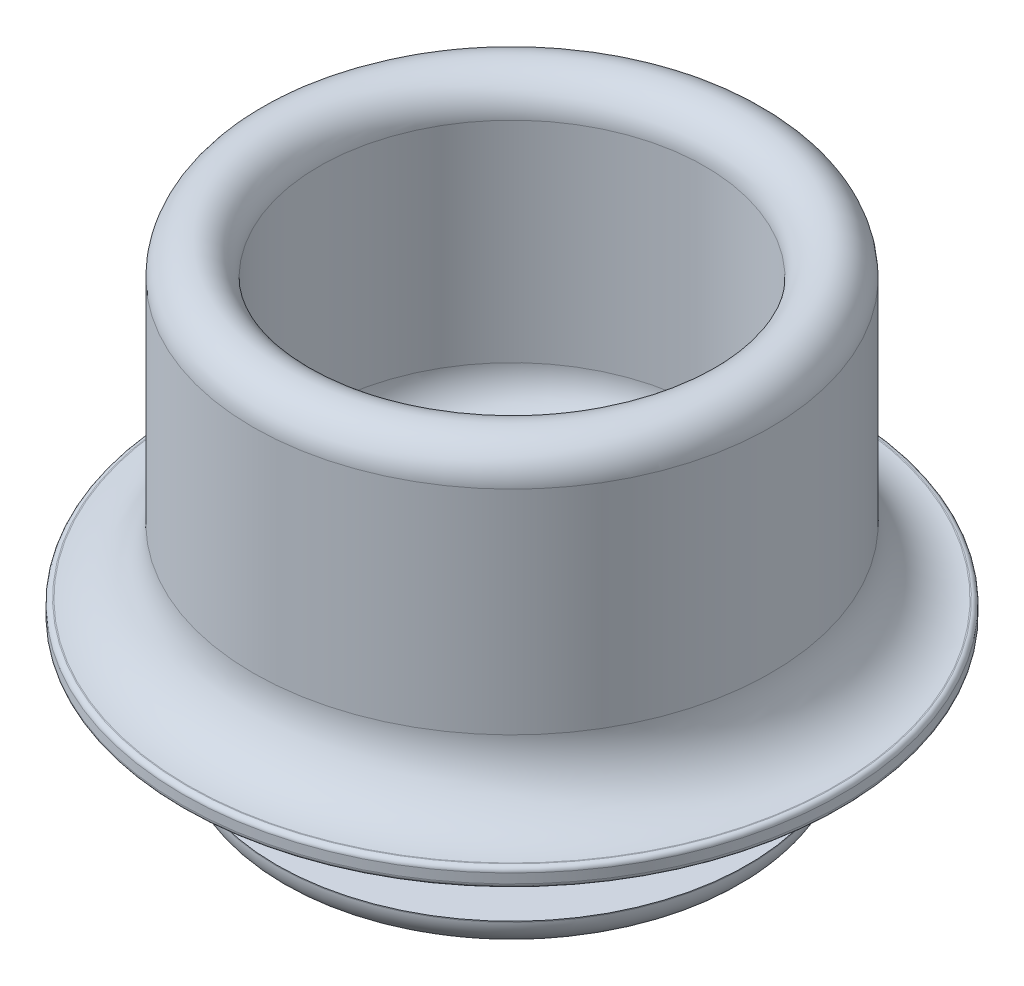
from build123d import *


with BuildPart() as part:
    # Esquisse1 → Révolution1 (revolve)
    with BuildSketch(Plane.XY, mode=Mode.PRIVATE) as r_volution1_sk:
        with BuildLine():
            Line((0, 0), (0, 0.3))
            Line((0, 0.3), (-0.008851171, 0.3))
            ThreePointArc((-0.008851171, 0.3), (-0.114917188, 0.343933983), (-0.158851171, 0.45))
            Line((-0.158851171, 0.45), (-0.158851171, 0.46))
            ThreePointArc((-0.158851171, 0.46), (-0.232074476, 0.636776695), (-0.408851171, 0.71))
            Line((-0.408851171, 0.71), (-1, 0.71))
            ThreePointArc((-1, 0.71), (-1.176776695, 0.636776695), (-1.25, 0.46))
            Line((-1.25, 0.46), (-1.25, 0.47))
            Line((-1.25, 0.47), (-1.6, 0.47))
            ThreePointArc((-1.6, 0.47), (-1.918198052, 0.601801948), (-2.05, 0.92))
            Line((-2.05, 0.92), (-2.05, 3.15))
            ThreePointArc((-2.05, 3.15), (-2.4, 3.5), (-2.75, 3.15))
            Line((-2.75, 3.15), (-2.75, 0.89))
            ThreePointArc((-2.75, 0.89), (-2.952096321, 0.402096321), (-3.44, 0.2))
            Line((-3.44, 0.2), (-3.45, 0.2))
            ThreePointArc((-3.45, 0.2), (-3.485355339, 0.185355339), (-3.5, 0.15))
            Line((-3.5, 0.15), (-3.5, 0.05))
            ThreePointArc((-3.5, 0.05), (-3.485355339, 0.014644661), (-3.45, 0))
            Line((-3.45, 0), (-1.5, 0))
            Line((-1.5, 0), (-1.5, -1))
            Line((-1.5, -1), (-2.501056659, -1))
            Line((-2.501056659, -1), (-2.501056659, -1.01))
            ThreePointArc((-2.501056659, -1.01), (-2.413188693, -1.222132034), (-2.201056659, -1.31))
            Line((-2.201056659, -1.31), (-0.15, -1.31))
            ThreePointArc((-0.15, -1.31), (-0.106066017, -1.203933983), (0, -1.16))
            Line((0, -1.16), (0, 0))
        make_face()
    revolve(r_volution1_sk.sketch.rotate(Axis((0, 1.513186813, 0), (0, -1, 0)), 270), axis=Axis((0, 1.513186813, 0), (0, -1, 0)))


solid = part.part
